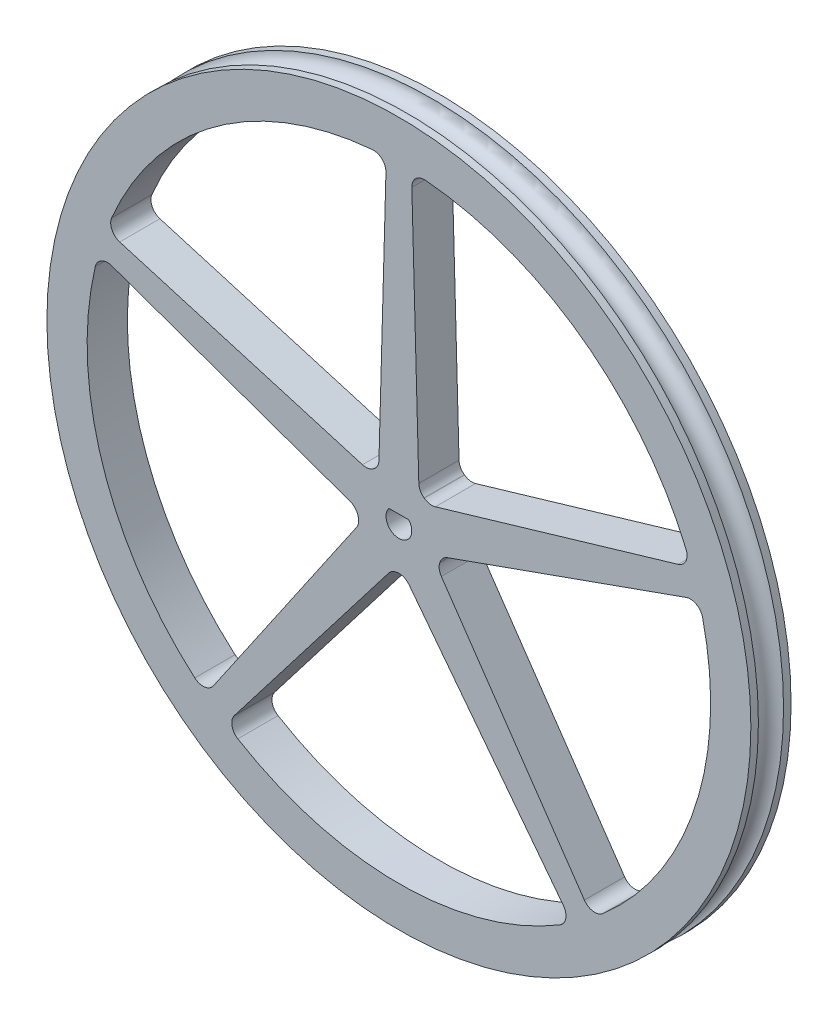
from build123d import *

# Parameters (mm, degrees)
SKETCH1_R           = 44.45
BOSS_EXTRUDE1_DEPTH = 2.54
SKETCH2_R           = 1.5875
CUT_EXTRUDE1_DEPTH  = 64.066721811
FILLET1_R           = 1.5875


with BuildPart() as part:
    # Sketch1 → Boss-Extrude1 (new, symmetric)
    with BuildSketch(Plane.XY):
        Circle(SKETCH1_R)
        with BuildLine():
            Line((1.248223297, 1.0414), (-1.248223297, 1.0414))
            ThreePointArc((-1.248223297, 1.0414), (0, -1.6256), (1.248223297, 1.0414))
        make_face(mode=Mode.SUBTRACT)
    extrude(amount=BOSS_EXTRUDE1_DEPTH, both=True)

    # Sketch2 → Cut-Revolve1 (revolve, cut)
    with BuildSketch(Plane(origin=(0, 0, 0), x_dir=(1, 0, 0), z_dir=(0, 1, 0))):
        with Locations((44.45, 0)):
            Circle(SKETCH2_R)
    revolve(axis=Axis((0, 0, 0), (0, 0, -1)), mode=Mode.SUBTRACT)

    # Sketch4 → Cut-Extrude1 (cut, through all)
    with BuildSketch(Plane.XY.offset(2.54)):
        with BuildLine():
            ThreePointArc((-3.785529256, 3.900707066), (-3.194965517, 4.397492775), (-2.54, 4.80563704))
            Line((-2.54, 4.80563704), (-1.5875, 39.337980931))
            ThreePointArc((-1.5875, 39.337980931), (-23.141105383, 31.850999069), (-36.922078624, 13.665906852))
            Line((-36.922078624, 13.665906852), (-3.785529256, 3.900707066))
        make_face()
        with BuildLine():
            Line((1.5875, 39.337980931), (2.54, 4.80563704))
            ThreePointArc((2.54, 4.80563704), (3.194965517, 4.397492775), (3.785529256, 3.900707066))
            Line((3.785529256, 3.900707066), (36.922078624, 13.665906852))
            ThreePointArc((36.922078624, 13.665906852), (23.141105383, 31.850999069), (1.5875, 39.337980931))
        make_face()
        with BuildLine():
            ThreePointArc((39.37, 0), (39.001578061, 5.373435471), (37.903207581, 10.646302413))
            Line((37.903207581, 10.646302413), (5.355335588, -0.930660037))
            ThreePointArc((5.355335588, -0.930660037), (5.1695628, -1.679692775), (4.879585746, -2.394867493))
            Line((4.879585746, -2.394867493), (24.406599525, -30.89198601))
            ThreePointArc((24.406599525, -30.89198601), (35.432222082, -17.162591248), (39.37, 0))
        make_face()
        with BuildLine():
            ThreePointArc((0.769779414, -5.380816575), (0, -5.4356), (-0.769779414, -5.380816575))
            Line((-0.769779414, -5.380816575), (-21.837970568, -32.758204186))
            ThreePointArc((-21.837970568, -32.758204186), (0, -39.37), (21.837970568, -32.758204186))
            Line((21.837970568, -32.758204186), (0.769779414, -5.380816575))
        make_face()
        with BuildLine():
            ThreePointArc((-4.879585746, -2.394867493), (-5.1695628, -1.679692775), (-5.355335588, -0.930660037))
            Line((-5.355335588, -0.930660037), (-37.903207581, 10.646302413))
            ThreePointArc((-37.903207581, 10.646302413), (-37.443095047, -12.165999069), (-24.406599525, -30.89198601))
            Line((-24.406599525, -30.89198601), (-4.879585746, -2.394867493))
        make_face()
    extrude(amount=-CUT_EXTRUDE1_DEPTH, mode=Mode.SUBTRACT)

    # Fillet1
    fillet1_edges = [part.edges().sort_by_distance(p)[0] for p in [
        (24.406599525, -30.89198601, 0),
        (4.879585746, -2.394867493, 0),
        (5.355335588, -0.930660037, 0),
        (37.903207581, 10.646302413, 0),
        (36.922078624, 13.665906852, 0),
        (3.785529256, 3.900707066, 0),
        (2.54, 4.80563704, 0),
        (1.5875, 39.337980931, 0),
        (-37.903207581, 10.646302413, 0),
        (-5.355335588, -0.930660037, 0),
        (-4.879585746, -2.394867493, 0),
        (-24.406599525, -30.89198601, 0),
        (-21.837970568, -32.758204186, 0),
        (-0.769779414, -5.380816575, 0),
        (0.769779414, -5.380816575, 0),
        (21.837970568, -32.758204186, 0),
        (-1.5875, 39.337980931, 0),
        (-2.54, 4.80563704, 0),
        (-3.785529256, 3.900707066, 0),
        (-36.922078624, 13.665906852, 0),
    ]]
    fillet(fillet1_edges, radius=FILLET1_R)


solid = part.part
